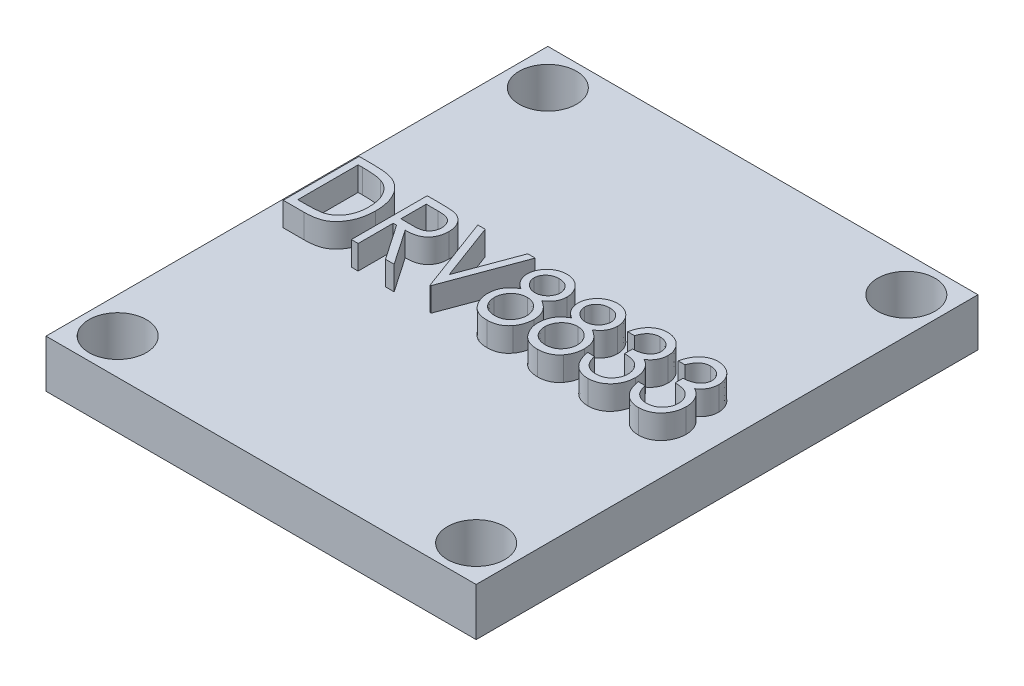
from build123d import *

# Parameters (mm, degrees)
SKETCH1_W           = 18
SKETCH1_H           = 21
SKETCH1_R           = 1.2
BOSS_EXTRUDE1_DEPTH = 2
BOSS_EXTRUDE2_DEPTH = 1


with BuildPart() as part:
    # Sketch1 → Boss-Extrude1 (new body)
    with BuildSketch(Plane(origin=(0, 0, 0), x_dir=(1, 0, 0), z_dir=(0, 1, 0))):
        Rectangle(SKETCH1_W, SKETCH1_H)
        with Locations(Location((-7.5, 9, 0), (0, 0, 270))):
            Circle(SKETCH1_R, mode=Mode.SUBTRACT)
        with Locations(Location((7.5, 9, 0), (0, 0, 270))):
            Circle(SKETCH1_R, mode=Mode.SUBTRACT)
        with Locations(Location((-7.5, -9, 0), (0, 0, 270))):
            Circle(SKETCH1_R, mode=Mode.SUBTRACT)
        with Locations(Location((7.5, -9, 0), (0, 0, 270))):
            Circle(SKETCH1_R, mode=Mode.SUBTRACT)
    extrude(amount=BOSS_EXTRUDE1_DEPTH)

    # Sketch3 → Boss-Extrude2 (add)
    # profile 1 of 7: a face of its own
    with BuildSketch(Plane(origin=(0, 2, 0), x_dir=(1, 0, 0), z_dir=(0, 1, 0))):
        with BuildLine():
            Line((-7.960071153, -1.612211939), (-7.960071153, 1.562788061))
            Line((-7.960071153, 1.562788061), (-7.388927323, 1.562788061))
            add(Edge.make_bspline(
                [(-7.388927323, 1.562788061), (-7.339101901, 1.562388392), (-7.243028105, 1.561617748), (-7.10430302, 1.556696109), (-6.976155205, 1.547981639), (-6.858841549, 1.535342458), (-6.751808562, 1.519656461), (-6.655527575, 1.50032874), (-6.569557312, 1.477153035), (-6.517035662, 1.457581178), (-6.492142467, 1.448304888)],
                knots=[0, 0, 0, 0, 1.315724667, 2.53699131, 3.664990376, 4.706723947, 5.652070057, 6.520539819, 7.298794104, 8, 8, 8, 8], degree=3))
            add(Edge.make_bspline(
                [(-6.492142467, 1.448304888), (-6.459431719, 1.434249953), (-6.394351066, 1.406286534), (-6.302016848, 1.354356083), (-6.21534767, 1.295002965), (-6.13376372, 1.228481468), (-6.058528837, 1.153911169), (-5.987737915, 1.072562875), (-5.92317458, 0.983414675), (-5.863976408, 0.887365616), (-5.811525894, 0.785186605), (-5.765474991, 0.677914724), (-5.726823565, 0.565834732), (-5.694903272, 0.448991518), (-5.670226665, 0.327230926), (-5.652366179, 0.200669554), (-5.6423445, 0.069368995), (-5.640709126, -0.019607579), (-5.639878845, -0.06478105)],
                knots=[0, 0, 0, 0, 0.924800359, 1.839964368, 2.747783831, 3.652252776, 4.571785451, 5.497553767, 6.451983905, 7.429142128, 8.427204497, 9.434321214, 10.460683131, 11.505979534, 12.580111876, 13.687410116, 14.825896436, 16, 16, 16, 16], degree=3))
            add(Edge.make_bspline(
                [(-5.639878845, -0.06478105), (-5.640237589, -0.104021454), (-5.64094442, -0.181336653), (-5.650413224, -0.295301221), (-5.664371873, -0.40565144), (-5.682919838, -0.51266773), (-5.708905095, -0.615878685), (-5.739072809, -0.715873357), (-5.775378361, -0.812147334), (-5.817468442, -0.904123068), (-5.863454223, -0.991478457), (-5.913560178, -1.073182882), (-5.965615961, -1.149813194), (-6.023072104, -1.219224485), (-6.082410945, -1.283741223), (-6.145803069, -1.341762887), (-6.212172048, -1.39430584), (-6.282643532, -1.441172301), (-6.358476595, -1.482371446), (-6.441116189, -1.517447074), (-6.53089762, -1.546223611), (-6.627548255, -1.570480293), (-6.731409141, -1.589583408), (-6.842546708, -1.602365536), (-6.960748931, -1.611072954), (-7.041856733, -1.611824688), (-7.083638861, -1.612211939)],
                knots=[0, 0, 0, 0, 1.170566915, 2.306362916, 3.409558859, 4.489123214, 5.544697587, 6.583245604, 7.604248301, 8.612055345, 9.599647246, 10.547858778, 11.470856558, 12.361035986, 13.233851144, 14.084492039, 14.922287147, 15.757427099, 16.606608392, 17.49372568, 18.431945823, 19.416941035, 20.465383131, 21.580359581, 22.753538819, 24, 24, 24, 24], degree=3))
            Line((-7.083638861, -1.612211939), (-7.960071153, -1.612211939))
        make_face()
        with BuildLine():
            Line((-7.675135256, -1.286570913), (-7.361578565, -1.286570913))
            add(Edge.make_bspline(
                [(-7.361578565, -1.286570913), (-7.316418401, -1.286350158), (-7.229896683, -1.285927216), (-7.105412118, -1.282096991), (-6.991729279, -1.275895943), (-6.888609243, -1.267245808), (-6.796356987, -1.255710995), (-6.714698538, -1.242889009), (-6.643772196, -1.226872555), (-6.601019922, -1.212475986), (-6.581184935, -1.205796675)],
                knots=[0, 0, 0, 0, 1.375935935, 2.63613619, 3.794191116, 4.844531808, 5.788349761, 6.626220458, 7.362632744, 8, 8, 8, 8], degree=3))
            add(Edge.make_bspline(
                [(-6.581184935, -1.205796675), (-6.556217292, -1.195568236), (-6.506673727, -1.175271834), (-6.435619209, -1.138432074), (-6.36956216, -1.094603549), (-6.306559555, -1.046469069), (-6.248732401, -0.991190485), (-6.194659474, -0.930839021), (-6.144615499, -0.864714079), (-6.099116836, -0.792918506), (-6.057837757, -0.716300864), (-6.02214499, -0.635261868), (-5.992310724, -0.550126488), (-5.967305702, -0.460964412), (-5.948604935, -0.367352431), (-5.934499791, -0.269929955), (-5.926072419, -0.168389877), (-5.925239526, -0.09935398), (-5.924814743, -0.064145032)],
                knots=[0, 0, 0, 0, 0.921437272, 1.828417929, 2.728287179, 3.626406277, 4.533155606, 5.456327229, 6.391997779, 7.362338549, 8.357046705, 9.362218445, 10.383770442, 11.436248382, 12.522758724, 13.64217368, 14.797486672, 16, 16, 16, 16], degree=3))
            add(Edge.make_bspline(
                [(-5.924814743, -0.064145032), (-5.925443885, -0.027024775), (-5.92667885, 0.045839864), (-5.935836191, 0.152860314), (-5.950145306, 0.255752845), (-5.971335263, 0.354484308), (-5.997893319, 0.449303225), (-6.030355974, 0.540179591), (-6.069185519, 0.626665854), (-6.113729823, 0.708661123), (-6.163043282, 0.785740764), (-6.21789642, 0.856498362), (-6.277456251, 0.92095002), (-6.340854785, 0.980062067), (-6.410268104, 1.031389182), (-6.483277517, 1.077569678), (-6.561607553, 1.116685122), (-6.61639751, 1.137540524), (-6.64415068, 1.148104567)],
                knots=[0, 0, 0, 0, 1.181456899, 2.31912264, 3.416650319, 4.486100574, 5.530800009, 6.549007929, 7.554886024, 8.545342906, 9.516858806, 10.464454463, 11.390981978, 12.307973961, 13.219011793, 14.134637004, 15.055123625, 16, 16, 16, 16], degree=3))
            add(Edge.make_bspline(
                [(-6.64415068, 1.148104567), (-6.666945911, 1.155467824), (-6.71540125, 1.171119743), (-6.794920983, 1.188157045), (-6.884479406, 1.203286127), (-6.984406527, 1.215988123), (-7.094553101, 1.225159901), (-7.214801612, 1.232027789), (-7.345429974, 1.236672411), (-7.435988325, 1.236984711), (-7.483057932, 1.237147035)],
                knots=[0, 0, 0, 0, 0.678535917, 1.442349433, 2.301734165, 3.252693306, 4.296065182, 5.433594972, 6.666057041, 8, 8, 8, 8], degree=3))
            Line((-7.483057932, 1.237147035), (-7.675135256, 1.237147035))
            Line((-7.675135256, 1.237147035), (-7.675135256, -1.286570913))
        make_face(mode=Mode.SUBTRACT)
    # profile 2 of 7: a face of its own
    with BuildSketch(Plane(origin=(0, 2, 0), x_dir=(1, 0, 0), z_dir=(0, 1, 0))):
        with BuildLine():
            Line((-5.110712179, 1.562788061), (-4.553560736, 1.562788061))
            add(Edge.make_bspline(
                [(-4.553560736, 1.562788061), (-4.51624802, 1.562648519), (-4.444797274, 1.562381309), (-4.342363299, 1.56085547), (-4.249320362, 1.556530756), (-4.165488682, 1.552812312), (-4.091118716, 1.545991611), (-4.026101066, 1.539588026), (-3.970450852, 1.530859333), (-3.936801094, 1.523099741), (-3.921359214, 1.519538862)],
                knots=[0, 0, 0, 0, 1.410548186, 2.701082353, 3.872164956, 4.931545487, 5.872643019, 6.694846481, 7.4010648, 8, 8, 8, 8], degree=3))
            add(Edge.make_bspline(
                [(-3.921359214, 1.519538862), (-3.901086918, 1.513781587), (-3.860765468, 1.502330408), (-3.802881129, 1.478299624), (-3.74746026, 1.450476672), (-3.694899137, 1.417948608), (-3.645899955, 1.380215332), (-3.59994018, 1.337883569), (-3.556366295, 1.291255915), (-3.51622011, 1.240027924), (-3.478857224, 1.185432353), (-3.447305698, 1.126862261), (-3.420566401, 1.065303461), (-3.397812132, 1.001081495), (-3.382104048, 0.933301722), (-3.368568101, 0.862997404), (-3.362068908, 0.789300944), (-3.360956306, 0.739153888), (-3.360391666, 0.713704527)],
                knots=[0, 0, 0, 0, 0.953385732, 1.896277294, 2.832058144, 3.758936013, 4.690028676, 5.627530842, 6.585110904, 7.575978385, 8.571622722, 9.576661008, 10.582432364, 11.608427265, 12.656015072, 13.729146958, 14.84755428, 16, 16, 16, 16], degree=3))
            add(Edge.make_bspline(
                [(-3.360391666, 0.713704527), (-3.361772323, 0.671440183), (-3.364459251, 0.589188625), (-3.384285686, 0.469619602), (-3.418157035, 0.358034921), (-3.465123738, 0.254856722), (-3.524248985, 0.161411029), (-3.595595097, 0.079288006), (-3.679333906, 0.010435032), (-3.757541787, -0.037525173), (-3.82671784, -0.068229811), (-3.883403846, -0.089692981), (-3.94536265, -0.106196135), (-4.011694372, -0.121143465), (-4.082881308, -0.132327822), (-4.158862723, -0.140548628), (-4.239511133, -0.145658033), (-4.294906009, -0.146430874), (-4.323322355, -0.146827324)],
                knots=[0, 0, 0, 0, 1.376286419, 2.678420862, 3.934476393, 5.16434824, 6.359712899, 7.524467423, 8.691553218, 9.878209641, 10.499433377, 11.154907673, 11.850203166, 12.585724918, 13.369062201, 14.195702105, 15.074435089, 16, 16, 16, 16], degree=3))
            Line((-4.323322355, -0.146827324), (-3.319686538, -1.612211939))
            Line((-3.319686538, -1.612211939), (-3.680944551, -1.612211939))
            Line((-3.680944551, -1.612211939), (-4.68394435, -0.146827324))
            Line((-4.68394435, -0.146827324), (-4.825776281, -0.146827324))
            Line((-4.825776281, -0.146827324), (-4.825776281, -1.612211939))
            Line((-4.825776281, -1.612211939), (-5.110712179, -1.612211939))
            Line((-5.110712179, -1.612211939), (-5.110712179, 1.562788061))
        make_face()
        with BuildLine():
            Line((-4.825776281, 1.237147035), (-4.825776281, 0.178813702))
            Line((-4.825776281, 0.178813702), (-4.344310937, 0.174361579))
            add(Edge.make_bspline(
                [(-4.344310937, 0.174361579), (-4.321832354, 0.174352278), (-4.278122016, 0.174334192), (-4.214944306, 0.177942121), (-4.156148082, 0.1820529), (-4.102031931, 0.188418843), (-4.052520393, 0.196456373), (-4.007521579, 0.206767136), (-3.967003802, 0.218469965), (-3.919469799, 0.237162314), (-3.866216613, 0.266230388), (-3.808398484, 0.308758399), (-3.759995076, 0.362191321), (-3.718470865, 0.422648556), (-3.685876277, 0.489652889), (-3.661969903, 0.56122811), (-3.647686964, 0.636599024), (-3.646120825, 0.688202828), (-3.645327563, 0.714340545)],
                knots=[0, 0, 0, 0, 1.065336973, 2.071582586, 2.998846003, 3.85897903, 4.653684173, 5.375320294, 6.046259432, 6.650926192, 7.793083249, 8.91264409, 10.036257247, 11.193087795, 12.379657337, 13.555538771, 14.761861912, 16, 16, 16, 16], degree=3))
            add(Edge.make_bspline(
                [(-3.645327563, 0.714340545), (-3.646035405, 0.739863997), (-3.647433855, 0.790289495), (-3.663004636, 0.863717943), (-3.686076288, 0.934089747), (-3.720402277, 0.998863619), (-3.760035013, 1.058758352), (-3.807872691, 1.10948582), (-3.861130533, 1.151666736), (-3.911405161, 1.178735979), (-3.956326721, 1.19542357), (-3.994981149, 1.206779091), (-4.038750338, 1.216374448), (-4.087668182, 1.223597916), (-4.14172385, 1.230128874), (-4.200936638, 1.234386238), (-4.265208857, 1.236963606), (-4.309751245, 1.237084373), (-4.332862619, 1.237147035)],
                knots=[0, 0, 0, 0, 1.234327139, 2.438602754, 3.620607776, 4.81008266, 5.97781748, 7.089343407, 8.171889953, 9.256139727, 9.837835946, 10.490922354, 11.205974105, 12.006200778, 12.885051669, 13.842733138, 14.880675122, 16, 16, 16, 16], degree=3))
            Line((-4.332862619, 1.237147035), (-4.825776281, 1.237147035))
        make_face(mode=Mode.SUBTRACT)
    # profile 3 of 7: a face of its own
    with BuildSketch(Plane(origin=(0, 2, 0), x_dir=(1, 0, 0), z_dir=(0, 1, 0))):
        Polygon((-2.994045512, 1.562788061), (-2.684940945, 1.562788061), (-1.79324423, -0.834998397), (-0.902183533, 1.562788061), (-0.592442948, 1.562788061), (-1.772891666, -1.612211939), (-1.813596794, -1.612211939), align=None)
    # profile 4 of 7: a face of its own
    with BuildSketch(Plane(origin=(0, 2, 0), x_dir=(1, 0, 0), z_dir=(0, 1, 0))):
        with BuildLine():
            add(Edge.make_bspline(
                [(1.08664359, 0.156553085), (1.109486988, 0.143027281), (1.153991087, 0.116675961), (1.216784475, 0.073657754), (1.274278017, 0.029200336), (1.327681528, -0.015659428), (1.374879048, -0.063290205), (1.417381356, -0.11177808), (1.454744846, -0.162021293), (1.497756977, -0.23040339), (1.541619597, -0.320949763), (1.578516133, -0.436816044), (1.601355396, -0.559767507), (1.604188374, -0.644304904), (1.605633975, -0.687442308)],
                knots=[0, 0, 0, 0, 0.914362454, 1.781384597, 2.619883779, 3.417600481, 4.181920405, 4.927374046, 5.637276055, 6.336350791, 7.708254165, 9.089438062, 10.514810145, 12, 12, 12, 12], degree=3))
            add(Edge.make_bspline(
                [(1.605633975, -0.687442308), (1.605102122, -0.718003663), (1.604050136, -0.778452846), (1.593276051, -0.867703624), (1.577231708, -0.954409164), (1.553121666, -1.038237451), (1.5236865, -1.119480081), (1.486759829, -1.197812986), (1.443998376, -1.273766702), (1.409779306, -1.321217905), (1.39256807, -1.345084535)],
                knots=[0, 0, 0, 0, 1.041882803, 2.060804048, 3.06202158, 4.046332822, 5.03231592, 6.006025776, 6.99708666, 8, 8, 8, 8], degree=3))
            add(Edge.make_bspline(
                [(1.39256807, -1.345084535), (1.370331814, -1.372815651), (1.326301316, -1.42772664), (1.249445207, -1.498827852), (1.16601013, -1.559375702), (1.075419063, -1.608850344), (0.977636712, -1.646809221), (0.872950012, -1.674479895), (0.76126411, -1.690148824), (0.68451622, -1.692446543), (0.645247357, -1.693622195)],
                knots=[0, 0, 0, 0, 0.994201578, 1.968640301, 2.92098468, 3.874697238, 4.850310626, 5.851048309, 6.900466311, 8, 8, 8, 8], degree=3))
            add(Edge.make_bspline(
                [(0.645247357, -1.693622195), (0.607258574, -1.692588204), (0.533557176, -1.690582173), (0.426265201, -1.676694352), (0.326387141, -1.652435376), (0.233015673, -1.619583234), (0.14720888, -1.575949392), (0.068599393, -1.522734182), (-0.003655422, -1.460633967), (-0.066944876, -1.388714068), (-0.122934507, -1.311508764), (-0.172029618, -1.231655352), (-0.2145583, -1.150358503), (-0.24798049, -1.06639865), (-0.275349437, -0.981135413), (-0.293252951, -0.893448431), (-0.305412484, -0.80417418), (-0.306805638, -0.743876938), (-0.307507051, -0.71351903)],
                knots=[0, 0, 0, 0, 1.189830096, 2.308369381, 3.38102576, 4.403937896, 5.401777142, 6.387120394, 7.37100814, 8.377427796, 9.380226239, 10.35513181, 11.31145126, 12.249850496, 13.182357426, 14.112259914, 15.049577746, 16, 16, 16, 16], degree=3))
            add(Edge.make_bspline(
                [(-0.307507051, -0.71351903), (-0.306045362, -0.669540393), (-0.303180121, -0.583332328), (-0.280507974, -0.457529805), (-0.242609352, -0.338778618), (-0.198945274, -0.245175895), (-0.156110863, -0.173755686), (-0.117441062, -0.122264934), (-0.07408693, -0.071914506), (-0.025519236, -0.022724875), (0.028499625, 0.024821106), (0.088104509, 0.070723502), (0.152756279, 0.115292716), (0.198806489, 0.142616073), (0.222295634, 0.156553085)],
                knots=[0, 0, 0, 0, 1.473281155, 2.887963909, 4.267687182, 5.640863319, 6.339108383, 7.055342466, 7.795973019, 8.564700607, 9.370150118, 10.205839621, 11.084840353, 12, 12, 12, 12], degree=3))
            add(Edge.make_bspline(
                [(0.222295634, 0.156553085), (0.189936832, 0.176754184), (0.12666348, 0.216254758), (0.043325142, 0.287371615), (-0.028049354, 0.364956376), (-0.085199119, 0.449988461), (-0.129919661, 0.539901896), (-0.161927724, 0.633546558), (-0.181818248, 0.730462598), (-0.184194479, 0.796293153), (-0.185391666, 0.829459736)],
                knots=[0, 0, 0, 0, 1.108078529, 2.1667008, 3.174911676, 4.165013377, 5.13557244, 6.087046531, 7.036220656, 8, 8, 8, 8], degree=3))
            add(Edge.make_bspline(
                [(-0.185391666, 0.829459736), (-0.184050773, 0.863279915), (-0.181360147, 0.931143213), (-0.159112862, 1.032067816), (-0.124145821, 1.13175196), (-0.074829903, 1.228390957), (-0.015027771, 1.320541824), (0.058538513, 1.402044014), (0.141339053, 1.474578742), (0.234761161, 1.534948547), (0.335023391, 1.583970037), (0.440821571, 1.618356686), (0.550208037, 1.640317726), (0.624790533, 1.642896993), (0.662419832, 1.644198317)],
                knots=[0, 0, 0, 0, 0.933393775, 1.872940412, 2.841657425, 3.844761966, 4.863186887, 5.867009188, 6.867494675, 7.895706246, 8.930319001, 9.941494413, 10.961416858, 12, 12, 12, 12], degree=3))
            add(Edge.make_bspline(
                [(0.662419832, 1.644198317), (0.69919649, 1.642883291), (0.77187976, 1.64028435), (0.878781343, 1.618585271), (0.981056641, 1.582598791), (1.078237862, 1.533540188), (1.168591509, 1.473061804), (1.248474328, 1.400302119), (1.318634679, 1.318194011), (1.377163181, 1.227026584), (1.424127242, 1.129770545), (1.459056017, 1.029199), (1.47917026, 0.925447463), (1.482065019, 0.855619063), (1.48351859, 0.820555489)],
                knots=[0, 0, 0, 0, 1.025177658, 2.026102131, 3.028615222, 4.041574873, 5.055259337, 6.051788893, 7.046052148, 8.059822865, 9.064931678, 10.052400243, 11.022033903, 12, 12, 12, 12], degree=3))
            add(Edge.make_bspline(
                [(1.48351859, 0.820555489), (1.482293547, 0.786128479), (1.479893157, 0.718671033), (1.461105241, 0.620347249), (1.429671618, 0.527960916), (1.386053733, 0.441097251), (1.329574849, 0.360451481), (1.260078043, 0.286152768), (1.179508715, 0.216257144), (1.1181365, 0.17680024), (1.08664359, 0.156553085)],
                knots=[0, 0, 0, 0, 1.017158402, 1.993054549, 2.946292347, 3.893578809, 4.856714948, 5.845702908, 6.894530941, 8, 8, 8, 8], degree=3))
        make_face()
        with BuildLine():
            add(Edge.make_bspline(
                [(0.647791427, 1.318557292), (0.628486741, 1.317965487), (0.590622329, 1.316804716), (0.534965338, 1.310729306), (0.482039746, 1.299011429), (0.431325702, 1.283417001), (0.38364014, 1.261765366), (0.337438069, 1.237536775), (0.294780802, 1.207052108), (0.254895456, 1.173061216), (0.219142127, 1.135629139), (0.186812656, 1.096938114), (0.160083261, 1.055785032), (0.137512831, 1.013146236), (0.120397694, 0.96848125), (0.108136004, 0.922229648), (0.101126322, 0.874195836), (0.100076823, 0.841566238), (0.099544232, 0.825007612)],
                knots=[0, 0, 0, 0, 1.128425343, 2.213305224, 3.265437279, 4.291949646, 5.307035918, 6.32144161, 7.335317645, 8.363249344, 9.379544413, 10.356652003, 11.304985507, 12.241430786, 13.170884807, 14.093377769, 15.032441564, 16, 16, 16, 16], degree=3))
            add(Edge.make_bspline(
                [(0.099544232, 0.825007612), (0.100024647, 0.808442982), (0.100972261, 0.775769407), (0.108826244, 0.727274574), (0.122327177, 0.680219036), (0.140843281, 0.634153142), (0.164779794, 0.589367899), (0.193191467, 0.545487665), (0.227543489, 0.503121705), (0.266340237, 0.462588767), (0.308443751, 0.424684215), (0.352921975, 0.391272255), (0.399929586, 0.363951646), (0.448129774, 0.340918067), (0.498176583, 0.32289742), (0.549971077, 0.310223155), (0.603453526, 0.302371047), (0.639708641, 0.301412059), (0.657967709, 0.300929087)],
                knots=[0, 0, 0, 0, 0.941109226, 1.856328975, 2.783214069, 3.718519893, 4.672576731, 5.66519449, 6.685154655, 7.767547646, 8.851281227, 9.90202341, 10.922908451, 11.936227576, 12.934824575, 13.940159871, 14.962608181, 16, 16, 16, 16], degree=3))
            add(Edge.make_bspline(
                [(0.657967709, 0.300929087), (0.681571787, 0.301722469), (0.728567176, 0.303302081), (0.797647646, 0.31796216), (0.864643354, 0.341228139), (0.929083481, 0.372792659), (0.989363237, 0.412323908), (1.042448569, 0.460276677), (1.089640332, 0.513756262), (1.127857556, 0.574296056), (1.158377935, 0.637691361), (1.182140056, 0.701768338), (1.195891804, 0.766542439), (1.197691358, 0.809894922), (1.198582693, 0.831367788)],
                knots=[0, 0, 0, 0, 1.013084994, 2.017038092, 3.019502504, 4.054223377, 5.092546353, 6.10542658, 7.119125627, 8.147492291, 9.170033384, 10.138140416, 11.077804571, 12, 12, 12, 12], degree=3))
            add(Edge.make_bspline(
                [(1.198582693, 0.831367788), (1.196825148, 0.861228864), (1.193317129, 0.920830854), (1.166002563, 1.008122347), (1.119810763, 1.090243957), (1.069644333, 1.154902302), (1.020540979, 1.201431059), (0.979341316, 1.233382212), (0.933617262, 1.259658743), (0.884050651, 1.28178054), (0.830506361, 1.297798028), (0.773153843, 1.310293527), (0.711762087, 1.316955754), (0.669429888, 1.318015562), (0.647791427, 1.318557292)],
                knots=[0, 0, 0, 0, 1.307320902, 2.609381067, 3.96494532, 5.420448181, 6.176278048, 6.925223031, 7.699726536, 8.48182856, 9.298861196, 10.144453644, 11.051521825, 12, 12, 12, 12], degree=3))
        make_face(mode=Mode.SUBTRACT)
        with BuildLine():
            add(Edge.make_bspline(
                [(0.663691868, -0.024711939), (0.639903048, -0.025229541), (0.592947716, -0.026251206), (0.524265762, -0.037138801), (0.458189583, -0.05252013), (0.39530243, -0.075812719), (0.335432114, -0.105769477), (0.278475486, -0.142452746), (0.22424013, -0.1851145), (0.173818863, -0.233944783), (0.127904489, -0.286758362), (0.087363763, -0.342342672), (0.053616389, -0.400372787), (0.026010382, -0.460696762), (0.004521416, -0.523148506), (-0.011872521, -0.587719643), (-0.020552882, -0.654767275), (-0.02189383, -0.700140792), (-0.022571153, -0.723059295)],
                knots=[0, 0, 0, 0, 1.048421666, 2.069416987, 3.060597679, 4.036932712, 5.019740262, 6.008093548, 7.02022806, 8.058591887, 9.099311237, 10.103813435, 11.088621048, 12.055279132, 13.02532386, 13.998339084, 14.988946113, 16, 16, 16, 16], degree=3))
            add(Edge.make_bspline(
                [(-0.022571153, -0.723059295), (-0.021695771, -0.751553611), (-0.019963516, -0.807939738), (-0.002876691, -0.891144125), (0.022725207, -0.972169339), (0.059990226, -1.049536366), (0.105488707, -1.121808043), (0.161402927, -1.185710441), (0.224944481, -1.241270907), (0.297022465, -1.287351601), (0.375948894, -1.323773471), (0.461529001, -1.348733241), (0.552581566, -1.365524126), (0.615486973, -1.367147501), (0.647791427, -1.36798117)],
                knots=[0, 0, 0, 0, 0.983353418, 1.945914075, 2.923520839, 3.913075695, 4.904716137, 5.865351531, 6.836321414, 7.811675056, 8.811399656, 9.82878879, 10.884995781, 12, 12, 12, 12], degree=3))
            add(Edge.make_bspline(
                [(0.647791427, -1.36798117), (0.672837411, -1.367382794), (0.722056808, -1.366206888), (0.793668194, -1.356648325), (0.861419346, -1.340615053), (0.924917709, -1.318393423), (0.985040793, -1.290190426), (1.040720504, -1.25532809), (1.092520235, -1.213858787), (1.139404426, -1.166540395), (1.181940412, -1.11520361), (1.218926707, -1.061071197), (1.250091523, -1.004717248), (1.276583982, -0.946909191), (1.296384268, -0.886483735), (1.310006397, -0.824012048), (1.31966187, -0.75939821), (1.320349233, -0.71546373), (1.320698078, -0.693166466)],
                knots=[0, 0, 0, 0, 1.127389244, 2.215501698, 3.245805524, 4.257141659, 5.239223727, 6.229804829, 7.207749447, 8.220211165, 9.223632865, 10.205900477, 11.167354178, 12.120096853, 13.064916475, 14.023665393, 14.996987016, 16, 16, 16, 16], degree=3))
            add(Edge.make_bspline(
                [(1.320698078, -0.693166466), (1.320053738, -0.671512296), (1.318784792, -0.628867121), (1.309675054, -0.56575286), (1.294318159, -0.504672037), (1.273222568, -0.445259731), (1.246435557, -0.387610287), (1.21311665, -0.332031915), (1.173391087, -0.278650048), (1.128629971, -0.227475961), (1.079693289, -0.180450757), (1.027909317, -0.138381499), (0.973091956, -0.103581251), (0.91610799, -0.074546309), (0.856582239, -0.052177179), (0.794532097, -0.036308935), (0.729940341, -0.026467716), (0.685987583, -0.02530284), (0.663691868, -0.024711939)],
                knots=[0, 0, 0, 0, 1.001088024, 1.971517479, 2.94155076, 3.908905619, 4.882498667, 5.876071198, 6.899515427, 7.955402232, 9.016146846, 10.034225051, 11.034929039, 12.012560479, 12.98664691, 13.968593758, 14.969537786, 16, 16, 16, 16], degree=3))
        make_face(mode=Mode.SUBTRACT)
    # profile 5 of 7: a face of its own
    with BuildSketch(Plane(origin=(0, 2, 0), x_dir=(1, 0, 0), z_dir=(0, 1, 0))):
        with BuildLine():
            add(Edge.make_bspline(
                [(3.203310257, 0.156553085), (3.226153655, 0.143027281), (3.270657754, 0.116675961), (3.333451142, 0.073657754), (3.390944684, 0.029200336), (3.444348195, -0.015659428), (3.491545715, -0.063290205), (3.534048023, -0.11177808), (3.571411513, -0.162021293), (3.614423643, -0.23040339), (3.658286264, -0.320949763), (3.6951828, -0.436816044), (3.718022063, -0.559767507), (3.720855041, -0.644304904), (3.722300642, -0.687442308)],
                knots=[0, 0, 0, 0, 0.914362454, 1.781384597, 2.619883779, 3.417600481, 4.181920405, 4.927374046, 5.637276055, 6.336350791, 7.708254165, 9.089438062, 10.514810145, 12, 12, 12, 12], degree=3))
            add(Edge.make_bspline(
                [(3.722300642, -0.687442308), (3.721768788, -0.718003663), (3.720716802, -0.778452846), (3.709942718, -0.867703624), (3.693898375, -0.954409164), (3.669788333, -1.038237451), (3.640353166, -1.119480081), (3.603426496, -1.197812986), (3.560665043, -1.273766702), (3.526445973, -1.321217905), (3.509234736, -1.345084535)],
                knots=[0, 0, 0, 0, 1.041882803, 2.060804048, 3.06202158, 4.046332822, 5.03231592, 6.006025776, 6.99708666, 8, 8, 8, 8], degree=3))
            add(Edge.make_bspline(
                [(3.509234736, -1.345084535), (3.48699848, -1.372815651), (3.442967983, -1.42772664), (3.366111874, -1.498827852), (3.282676796, -1.559375702), (3.19208573, -1.608850344), (3.094303378, -1.646809221), (2.989616678, -1.674479895), (2.877930777, -1.690148824), (2.801182887, -1.692446543), (2.761914023, -1.693622195)],
                knots=[0, 0, 0, 0, 0.994201578, 1.968640301, 2.92098468, 3.874697238, 4.850310626, 5.851048309, 6.900466311, 8, 8, 8, 8], degree=3))
            add(Edge.make_bspline(
                [(2.761914023, -1.693622195), (2.723925241, -1.692588204), (2.650223843, -1.690582173), (2.542931868, -1.676694352), (2.443053808, -1.652435376), (2.34968234, -1.619583234), (2.263875547, -1.575949392), (2.185266059, -1.522734182), (2.113011244, -1.460633967), (2.04972179, -1.388714068), (1.993732159, -1.311508764), (1.944637049, -1.231655352), (1.902108367, -1.150358503), (1.868686177, -1.06639865), (1.841317229, -0.981135413), (1.823413716, -0.893448431), (1.811254182, -0.80417418), (1.809861029, -0.743876938), (1.809159616, -0.71351903)],
                knots=[0, 0, 0, 0, 1.189830096, 2.308369381, 3.38102576, 4.403937896, 5.401777142, 6.387120394, 7.37100814, 8.377427796, 9.380226239, 10.35513181, 11.31145126, 12.249850496, 13.182357426, 14.112259914, 15.049577746, 16, 16, 16, 16], degree=3))
            add(Edge.make_bspline(
                [(1.809159616, -0.71351903), (1.810621305, -0.669540393), (1.813486545, -0.583332328), (1.836158692, -0.457529805), (1.874057315, -0.338778618), (1.917721393, -0.245175895), (1.960555804, -0.173755686), (1.999225605, -0.122264934), (2.042579736, -0.071914506), (2.09114743, -0.022724875), (2.145166292, 0.024821106), (2.204771176, 0.070723502), (2.269422945, 0.115292716), (2.315473155, 0.142616073), (2.3389623, 0.156553085)],
                knots=[0, 0, 0, 0, 1.473281155, 2.887963909, 4.267687182, 5.640863319, 6.339108383, 7.055342466, 7.795973019, 8.564700607, 9.370150118, 10.205839621, 11.084840353, 12, 12, 12, 12], degree=3))
            add(Edge.make_bspline(
                [(2.3389623, 0.156553085), (2.306603498, 0.176754184), (2.243330146, 0.216254758), (2.159991808, 0.287371615), (2.088617312, 0.364956376), (2.031467548, 0.449988461), (1.986747005, 0.539901896), (1.954738943, 0.633546558), (1.934848418, 0.730462598), (1.932472187, 0.796293153), (1.931275001, 0.829459736)],
                knots=[0, 0, 0, 0, 1.108078529, 2.1667008, 3.174911676, 4.165013377, 5.13557244, 6.087046531, 7.036220656, 8, 8, 8, 8], degree=3))
            add(Edge.make_bspline(
                [(1.931275001, 0.829459736), (1.932615894, 0.863279915), (1.935306519, 0.931143213), (1.957553805, 1.032067816), (1.992520846, 1.13175196), (2.041836764, 1.228390957), (2.101638895, 1.320541824), (2.17520518, 1.402044014), (2.258005719, 1.474578742), (2.351427828, 1.534948547), (2.451690058, 1.583970037), (2.557488238, 1.618356686), (2.666874704, 1.640317726), (2.7414572, 1.642896993), (2.779086499, 1.644198317)],
                knots=[0, 0, 0, 0, 0.933393775, 1.872940412, 2.841657425, 3.844761966, 4.863186887, 5.867009188, 6.867494675, 7.895706246, 8.930319001, 9.941494413, 10.961416858, 12, 12, 12, 12], degree=3))
            add(Edge.make_bspline(
                [(2.779086499, 1.644198317), (2.815863157, 1.642883291), (2.888546427, 1.64028435), (2.99544801, 1.618585271), (3.097723308, 1.582598791), (3.194904529, 1.533540188), (3.285258176, 1.473061804), (3.365140994, 1.400302119), (3.435301346, 1.318194011), (3.493829848, 1.227026584), (3.540793909, 1.129770545), (3.575722684, 1.029199), (3.595836927, 0.925447463), (3.598731686, 0.855619063), (3.600185257, 0.820555489)],
                knots=[0, 0, 0, 0, 1.025177658, 2.026102131, 3.028615222, 4.041574873, 5.055259337, 6.051788893, 7.046052148, 8.059822865, 9.064931678, 10.052400243, 11.022033903, 12, 12, 12, 12], degree=3))
            add(Edge.make_bspline(
                [(3.600185257, 0.820555489), (3.598960214, 0.786128479), (3.596559823, 0.718671033), (3.577771908, 0.620347249), (3.546338285, 0.527960916), (3.502720399, 0.441097251), (3.446241516, 0.360451481), (3.376744709, 0.286152768), (3.296175382, 0.216257144), (3.234803167, 0.17680024), (3.203310257, 0.156553085)],
                knots=[0, 0, 0, 0, 1.017158402, 1.993054549, 2.946292347, 3.893578809, 4.856714948, 5.845702908, 6.894530941, 8, 8, 8, 8], degree=3))
        make_face()
        with BuildLine():
            add(Edge.make_bspline(
                [(2.764458094, 1.318557292), (2.745153408, 1.317965487), (2.707288995, 1.316804716), (2.651632005, 1.310729306), (2.598706412, 1.299011429), (2.547992369, 1.283417001), (2.500306807, 1.261765366), (2.454104736, 1.237536775), (2.411447469, 1.207052108), (2.371562122, 1.173061216), (2.335808793, 1.135629139), (2.303479323, 1.096938114), (2.276749928, 1.055785032), (2.254179498, 1.013146236), (2.23706436, 0.96848125), (2.22480267, 0.922229648), (2.217792989, 0.874195836), (2.21674349, 0.841566238), (2.216210898, 0.825007612)],
                knots=[0, 0, 0, 0, 1.128425343, 2.213305224, 3.265437279, 4.291949646, 5.307035918, 6.32144161, 7.335317645, 8.363249344, 9.379544413, 10.356652003, 11.304985507, 12.241430786, 13.170884807, 14.093377769, 15.032441564, 16, 16, 16, 16], degree=3))
            add(Edge.make_bspline(
                [(2.216210898, 0.825007612), (2.216691313, 0.808442982), (2.217638928, 0.775769407), (2.22549291, 0.727274574), (2.238993844, 0.680219036), (2.257509948, 0.634153142), (2.281446461, 0.589367899), (2.309858134, 0.545487665), (2.344210156, 0.503121705), (2.383006904, 0.462588767), (2.425110417, 0.424684215), (2.469588642, 0.391272255), (2.516596253, 0.363951646), (2.56479644, 0.340918067), (2.61484325, 0.32289742), (2.666637744, 0.310223155), (2.720120192, 0.302371047), (2.756375308, 0.301412059), (2.774634376, 0.300929087)],
                knots=[0, 0, 0, 0, 0.941109226, 1.856328975, 2.783214069, 3.718519893, 4.672576731, 5.66519449, 6.685154655, 7.767547646, 8.851281227, 9.90202341, 10.922908451, 11.936227576, 12.934824575, 13.940159871, 14.962608181, 16, 16, 16, 16], degree=3))
            add(Edge.make_bspline(
                [(2.774634376, 0.300929087), (2.798238453, 0.301722469), (2.845233843, 0.303302081), (2.914314313, 0.31796216), (2.98131002, 0.341228139), (3.045750147, 0.372792659), (3.106029903, 0.412323908), (3.159115236, 0.460276677), (3.206306998, 0.513756262), (3.244524223, 0.574296056), (3.275044601, 0.637691361), (3.298806722, 0.701768338), (3.312558471, 0.766542439), (3.314358025, 0.809894922), (3.31524936, 0.831367788)],
                knots=[0, 0, 0, 0, 1.013084994, 2.017038092, 3.019502504, 4.054223377, 5.092546353, 6.10542658, 7.119125627, 8.147492291, 9.170033384, 10.138140416, 11.077804571, 12, 12, 12, 12], degree=3))
            add(Edge.make_bspline(
                [(3.31524936, 0.831367788), (3.313491814, 0.861228864), (3.309983796, 0.920830854), (3.28266923, 1.008122347), (3.236477429, 1.090243957), (3.186310999, 1.154902302), (3.137207646, 1.201431059), (3.096007983, 1.233382212), (3.050283929, 1.259658743), (3.000717318, 1.28178054), (2.947173028, 1.297798028), (2.889820509, 1.310293527), (2.828428754, 1.316955754), (2.786096554, 1.318015562), (2.764458094, 1.318557292)],
                knots=[0, 0, 0, 0, 1.307320902, 2.609381067, 3.96494532, 5.420448181, 6.176278048, 6.925223031, 7.699726536, 8.48182856, 9.298861196, 10.144453644, 11.051521825, 12, 12, 12, 12], degree=3))
        make_face(mode=Mode.SUBTRACT)
        with BuildLine():
            add(Edge.make_bspline(
                [(2.780358534, -0.024711939), (2.756569715, -0.025229541), (2.709614382, -0.026251206), (2.640932429, -0.037138801), (2.57485625, -0.05252013), (2.511969096, -0.075812719), (2.452098781, -0.105769477), (2.395142152, -0.142452746), (2.340906797, -0.1851145), (2.29048553, -0.233944783), (2.244571156, -0.286758362), (2.20403043, -0.342342672), (2.170283056, -0.400372787), (2.142677048, -0.460696762), (2.121188082, -0.523148506), (2.104794146, -0.587719643), (2.096113785, -0.654767275), (2.094772837, -0.700140792), (2.094095514, -0.723059295)],
                knots=[0, 0, 0, 0, 1.048421666, 2.069416987, 3.060597679, 4.036932712, 5.019740262, 6.008093548, 7.02022806, 8.058591887, 9.099311237, 10.103813435, 11.088621048, 12.055279132, 13.02532386, 13.998339084, 14.988946113, 16, 16, 16, 16], degree=3))
            add(Edge.make_bspline(
                [(2.094095514, -0.723059295), (2.094970896, -0.751553611), (2.096703151, -0.807939738), (2.113789975, -0.891144125), (2.139391873, -0.972169339), (2.176656893, -1.049536366), (2.222155374, -1.121808043), (2.278069594, -1.185710441), (2.341611148, -1.241270907), (2.413689131, -1.287351601), (2.49261556, -1.323773471), (2.578195667, -1.348733241), (2.669248233, -1.365524126), (2.732153639, -1.367147501), (2.764458094, -1.36798117)],
                knots=[0, 0, 0, 0, 0.983353418, 1.945914075, 2.923520839, 3.913075695, 4.904716137, 5.865351531, 6.836321414, 7.811675056, 8.811399656, 9.82878879, 10.884995781, 12, 12, 12, 12], degree=3))
            add(Edge.make_bspline(
                [(2.764458094, -1.36798117), (2.789504077, -1.367382794), (2.838723475, -1.366206888), (2.91033486, -1.356648325), (2.978086013, -1.340615053), (3.041584376, -1.318393423), (3.10170746, -1.290190426), (3.157387171, -1.25532809), (3.209186901, -1.213858787), (3.256071092, -1.166540395), (3.298607078, -1.11520361), (3.335593373, -1.061071197), (3.36675819, -1.004717248), (3.393250649, -0.946909191), (3.413050935, -0.886483735), (3.426673064, -0.824012048), (3.436328537, -0.75939821), (3.4370159, -0.71546373), (3.437364744, -0.693166466)],
                knots=[0, 0, 0, 0, 1.127389244, 2.215501698, 3.245805524, 4.257141659, 5.239223727, 6.229804829, 7.207749447, 8.220211165, 9.223632865, 10.205900477, 11.167354178, 12.120096853, 13.064916475, 14.023665393, 14.996987016, 16, 16, 16, 16], degree=3))
            add(Edge.make_bspline(
                [(3.437364744, -0.693166466), (3.436720405, -0.671512296), (3.435451458, -0.628867121), (3.42634172, -0.56575286), (3.410984826, -0.504672037), (3.389889235, -0.445259731), (3.363102223, -0.387610287), (3.329783317, -0.332031915), (3.290057754, -0.278650048), (3.245296638, -0.227475961), (3.196359955, -0.180450757), (3.144575984, -0.138381499), (3.089758623, -0.103581251), (3.032774657, -0.074546309), (2.973248905, -0.052177179), (2.911198764, -0.036308935), (2.846607008, -0.026467716), (2.80265425, -0.02530284), (2.780358534, -0.024711939)],
                knots=[0, 0, 0, 0, 1.001088024, 1.971517479, 2.94155076, 3.908905619, 4.882498667, 5.876071198, 6.899515427, 7.955402232, 9.016146846, 10.034225051, 11.034929039, 12.012560479, 12.98664691, 13.968593758, 14.969537786, 16, 16, 16, 16], degree=3))
        make_face(mode=Mode.SUBTRACT)
    # profile 6 of 7: a face of its own
    with BuildSketch(Plane(origin=(0, 2, 0), x_dir=(1, 0, 0), z_dir=(0, 1, 0))):
        with BuildLine():
            Line((4.292172437, 0.830095753), (4.007236539, 0.830095753))
            add(Edge.make_bspline(
                [(4.007236539, 0.830095753), (4.014456393, 0.862002203), (4.028530813, 0.924200798), (4.05614169, 1.013898825), (4.088482862, 1.097836313), (4.125410455, 1.176300177), (4.166629431, 1.249358437), (4.213556241, 1.316201954), (4.264018263, 1.378456994), (4.320490671, 1.433329891), (4.379262119, 1.483439389), (4.441920382, 1.525766866), (4.506578841, 1.562605406), (4.574067787, 1.592587148), (4.644477803, 1.615462708), (4.717483895, 1.631995607), (4.793044838, 1.642562439), (4.844412943, 1.643649983), (4.870312461, 1.644198317)],
                knots=[0, 0, 0, 0, 1.213646873, 2.365889363, 3.479226314, 4.54912843, 5.581579656, 6.587705624, 7.576924878, 8.55050232, 9.505464024, 10.439453725, 11.351887816, 12.264152294, 13.174752891, 14.094686289, 15.039351257, 16, 16, 16, 16], degree=3))
            add(Edge.make_bspline(
                [(4.870312461, 1.644198317), (4.908156493, 1.642935274), (4.983205553, 1.640430513), (5.093345447, 1.617865235), (5.199496746, 1.581867376), (5.300575522, 1.532477664), (5.394475951, 1.471290891), (5.478056139, 1.398831839), (5.549842189, 1.316062696), (5.609336122, 1.224371622), (5.656704023, 1.127053637), (5.691541757, 1.026585494), (5.712708453, 0.92362565), (5.715467398, 0.854149023), (5.716851924, 0.819283454)],
                knots=[0, 0, 0, 0, 1.037475548, 2.057433109, 3.071083532, 4.106583696, 5.136003477, 6.138035553, 7.131860785, 8.132253496, 9.128731291, 10.094580144, 11.043800018, 12, 12, 12, 12], degree=3))
            add(Edge.make_bspline(
                [(5.716851924, 0.819283454), (5.715753793, 0.785716771), (5.713606137, 0.720069121), (5.69670472, 0.624274946), (5.668682998, 0.533770429), (5.628916097, 0.448729318), (5.578097803, 0.368918543), (5.515848678, 0.295048269), (5.442761824, 0.226075403), (5.387267924, 0.186443015), (5.358773999, 0.166093349)],
                knots=[0, 0, 0, 0, 1.034740432, 2.023681557, 2.989439786, 3.948891607, 4.910213012, 5.898894732, 6.921165452, 8, 8, 8, 8], degree=3))
            add(Edge.make_bspline(
                [(5.358773999, 0.166093349), (5.389160579, 0.149708404), (5.449820333, 0.116999663), (5.532010913, 0.05377129), (5.606366263, -0.019772331), (5.647623875, -0.076251863), (5.668514584, -0.10485016)],
                knots=[0, 0, 0, 0, 0.994457701, 1.985203988, 2.979812114, 4, 4, 4, 4], degree=3))
            add(Edge.make_bspline(
                [(5.668514584, -0.10485016), (5.682270807, -0.125814802), (5.70966606, -0.167565481), (5.743417311, -0.233998013), (5.773173772, -0.301807296), (5.797261508, -0.371556052), (5.815733233, -0.443274301), (5.829051009, -0.516812511), (5.83768016, -0.592257591), (5.838536648, -0.643321717), (5.838967308, -0.668997796)],
                knots=[0, 0, 0, 0, 1.00515716, 2.001751025, 2.984458985, 3.97420733, 4.958128942, 5.952324961, 6.970387383, 8, 8, 8, 8], degree=3))
            add(Edge.make_bspline(
                [(5.838967308, -0.668997796), (5.837272517, -0.71340154), (5.833899733, -0.801768884), (5.809864019, -0.932975516), (5.76855617, -1.060380687), (5.712986132, -1.183266996), (5.643872731, -1.297719011), (5.561706502, -1.400167884), (5.46754539, -1.488685081), (5.362244417, -1.562422801), (5.248196759, -1.621602986), (5.126037318, -1.662508424), (4.997623433, -1.689362386), (4.909459697, -1.692185405), (4.864588302, -1.693622195)],
                knots=[0, 0, 0, 0, 1.014707837, 2.019357588, 3.036907717, 4.069166202, 5.095504868, 6.084608755, 7.061626644, 8.038980938, 9.014218756, 9.987287233, 10.975619287, 12, 12, 12, 12], degree=3))
            add(Edge.make_bspline(
                [(4.864588302, -1.693622195), (4.834456332, -1.692839855), (4.775266916, -1.691303074), (4.688256359, -1.68065431), (4.605333592, -1.66125642), (4.526076959, -1.635215138), (4.450400591, -1.60188912), (4.378382588, -1.561284124), (4.310555721, -1.512433595), (4.246991548, -1.456298238), (4.187583049, -1.393387103), (4.134073728, -1.322788833), (4.085651542, -1.245481809), (4.04243894, -1.161454034), (4.004822819, -1.070337978), (3.972609582, -0.972547474), (3.945685197, -0.867553511), (3.932570856, -0.79481363), (3.925826283, -0.757404247)],
                knots=[0, 0, 0, 0, 0.990513423, 1.945704551, 2.875515556, 3.785713825, 4.684393021, 5.589454026, 6.498450854, 7.426798081, 8.373433753, 9.338011181, 10.333830724, 11.368661367, 12.440314751, 13.570898844, 14.750737914, 16, 16, 16, 16], degree=3))
            Line((3.925826283, -0.757404247), (4.21076218, -0.757404247))
            add(Edge.make_bspline(
                [(4.21076218, -0.757404247), (4.216819337, -0.781871434), (4.228598469, -0.829451883), (4.250751121, -0.897290155), (4.272981814, -0.960547674), (4.298729267, -1.017942906), (4.325980827, -1.070291635), (4.355206487, -1.11771961), (4.386704562, -1.159727434), (4.410031958, -1.184369984), (4.421284015, -1.19625641)],
                knots=[0, 0, 0, 0, 1.227409514, 2.386898646, 3.474821375, 4.49196229, 5.448190758, 6.348047463, 7.203174547, 8, 8, 8, 8], degree=3))
            add(Edge.make_bspline(
                [(4.421284015, -1.19625641), (4.436294834, -1.209920898), (4.466025004, -1.236984549), (4.514908015, -1.272005725), (4.566299322, -1.302464515), (4.621666013, -1.325397826), (4.679027658, -1.345158079), (4.739904465, -1.358048597), (4.803698921, -1.366795631), (4.847384471, -1.367580609), (4.869676443, -1.36798117)],
                knots=[0, 0, 0, 0, 0.987786239, 1.956392453, 2.923291289, 3.889914458, 4.869410071, 5.873943724, 6.915110651, 8, 8, 8, 8], degree=3))
            add(Edge.make_bspline(
                [(4.869676443, -1.36798117), (4.894944339, -1.367436389), (4.944184969, -1.36637475), (5.016031906, -1.356168071), (5.084323105, -1.341727512), (5.148339507, -1.3186466), (5.209350853, -1.291074301), (5.265854902, -1.255790001), (5.318622566, -1.214545551), (5.367204255, -1.16785491), (5.410591553, -1.116560423), (5.448933762, -1.062992182), (5.481949052, -1.007508767), (5.50762749, -0.949150186), (5.529221462, -0.889213736), (5.543693355, -0.826670667), (5.551921151, -0.762076901), (5.553322803, -0.718418266), (5.554031411, -0.696346554)],
                knots=[0, 0, 0, 0, 1.131388683, 2.204785482, 3.246441662, 4.252851856, 5.247356788, 6.241181003, 7.22926868, 8.243715995, 9.254465245, 10.235036049, 11.192984918, 12.141087045, 13.087426855, 14.043631555, 15.010953923, 16, 16, 16, 16], degree=3))
            add(Edge.make_bspline(
                [(5.554031411, -0.696346554), (5.552947053, -0.6667934), (5.550790931, -0.60803028), (5.532941267, -0.521576753), (5.504196854, -0.438133015), (5.463985047, -0.359026637), (5.414976684, -0.285706039), (5.357471249, -0.220452645), (5.291014573, -0.166110479), (5.229382139, -0.128313552), (5.174608605, -0.103158487), (5.128116765, -0.085893218), (5.076232533, -0.071755839), (5.019471243, -0.058131235), (4.957025096, -0.046881302), (4.889325948, -0.037531221), (4.816362432, -0.029778185), (4.766020158, -0.026441349), (4.739928847, -0.024711939)],
                knots=[0, 0, 0, 0, 1.19277501, 2.371698767, 3.54972029, 4.748382554, 5.945391955, 7.103829679, 8.24739154, 9.400245482, 10.013276171, 10.679775806, 11.400814213, 12.18386578, 13.037095876, 13.962316118, 14.943912534, 16, 16, 16, 16], degree=3))
            Line((4.739928847, -0.024711939), (4.739928847, 0.300929087))
            add(Edge.make_bspline(
                [(4.739928847, 0.300929087), (4.773280013, 0.301613992), (4.838835762, 0.302960257), (4.934347711, 0.318600367), (5.025914343, 0.340905785), (5.111186296, 0.373984062), (5.188946695, 0.413380404), (5.25656147, 0.458323506), (5.312287902, 0.509247628), (5.356747624, 0.565202138), (5.390503725, 0.625077305), (5.414213408, 0.687966925), (5.429755034, 0.753227785), (5.431191901, 0.797994706), (5.431916026, 0.820555489)],
                knots=[0, 0, 0, 0, 1.243740816, 2.444722913, 3.604071008, 4.756374622, 5.850061341, 6.853181308, 7.777365241, 8.656145985, 9.510167359, 10.331781837, 11.159283104, 12, 12, 12, 12], degree=3))
            add(Edge.make_bspline(
                [(5.431916026, 0.820555489), (5.431440535, 0.83712255), (5.43049662, 0.870010409), (5.422579935, 0.918158139), (5.410348232, 0.964835811), (5.393447839, 1.009805993), (5.370638386, 1.052894306), (5.343321631, 1.094355516), (5.310638529, 1.133740426), (5.273734566, 1.171055857), (5.233701372, 1.206152992), (5.189508265, 1.235695571), (5.143327082, 1.261667336), (5.094491925, 1.282524626), (5.042893398, 1.298576358), (4.988790834, 1.30985028), (4.931984596, 1.317032969), (4.893230835, 1.318042905), (4.873492549, 1.318557292)],
                knots=[0, 0, 0, 0, 0.954298075, 1.894410913, 2.804261135, 3.732387345, 4.655998667, 5.60826082, 6.589174048, 7.600068601, 8.631142096, 9.651225118, 10.65760524, 11.681194716, 12.705294547, 13.766901717, 14.862625692, 16, 16, 16, 16], degree=3))
            add(Edge.make_bspline(
                [(4.873492549, 1.318557292), (4.841776454, 1.317297679), (4.779732997, 1.314833608), (4.690353121, 1.293033885), (4.607304852, 1.258462284), (4.544203984, 1.217346227), (4.497914651, 1.176702771), (4.464117559, 1.141741555), (4.43205212, 1.101540216), (4.40106523, 1.056794411), (4.372105085, 1.006646532), (4.343082949, 0.952714191), (4.316539615, 0.893256603), (4.300462419, 0.851583769), (4.292172437, 0.830095753)],
                knots=[0, 0, 0, 0, 1.395445339, 2.729789254, 4.027341734, 5.343352216, 6.025171276, 6.738565338, 7.482488129, 8.288221053, 9.133992859, 10.032284056, 10.985374711, 12, 12, 12, 12], degree=3))
        make_face()
    # profile 7 of 7: a face of its own
    with BuildSketch(Plane(origin=(0, 2, 0), x_dir=(1, 0, 0), z_dir=(0, 1, 0))):
        with BuildLine():
            Line((6.408839103, 0.830095753), (6.123903206, 0.830095753))
            add(Edge.make_bspline(
                [(6.123903206, 0.830095753), (6.13112306, 0.862002203), (6.14519748, 0.924200798), (6.172808357, 1.013898825), (6.205149528, 1.097836313), (6.242077122, 1.176300177), (6.283296098, 1.249358437), (6.330222908, 1.316201954), (6.38068493, 1.378456994), (6.437157337, 1.433329891), (6.495928786, 1.483439389), (6.558587048, 1.525766866), (6.623245508, 1.562605406), (6.690734453, 1.592587148), (6.76114447, 1.615462708), (6.834150562, 1.631995607), (6.909711505, 1.642562439), (6.96107961, 1.643649983), (6.986979127, 1.644198317)],
                knots=[0, 0, 0, 0, 1.213646873, 2.365889363, 3.479226314, 4.54912843, 5.581579656, 6.587705624, 7.576924878, 8.55050232, 9.505464024, 10.439453725, 11.351887816, 12.264152294, 13.174752891, 14.094686289, 15.039351257, 16, 16, 16, 16], degree=3))
            add(Edge.make_bspline(
                [(6.986979127, 1.644198317), (7.024823159, 1.642935274), (7.099872219, 1.640430513), (7.210012114, 1.617865235), (7.316163412, 1.581867376), (7.417242189, 1.532477664), (7.511142618, 1.471290891), (7.594722806, 1.398831839), (7.666508856, 1.316062696), (7.726002788, 1.224371622), (7.773370689, 1.127053637), (7.808208424, 1.026585494), (7.829375119, 0.92362565), (7.832134065, 0.854149023), (7.83351859, 0.819283454)],
                knots=[0, 0, 0, 0, 1.037475548, 2.057433109, 3.071083532, 4.106583696, 5.136003477, 6.138035553, 7.131860785, 8.132253496, 9.128731291, 10.094580144, 11.043800018, 12, 12, 12, 12], degree=3))
            add(Edge.make_bspline(
                [(7.83351859, 0.819283454), (7.83242046, 0.785716771), (7.830272804, 0.720069121), (7.813371387, 0.624274946), (7.785349664, 0.533770429), (7.745582763, 0.448729318), (7.694764469, 0.368918543), (7.632515345, 0.295048269), (7.559428491, 0.226075403), (7.503934591, 0.186443015), (7.475440666, 0.166093349)],
                knots=[0, 0, 0, 0, 1.034740432, 2.023681557, 2.989439786, 3.948891607, 4.910213012, 5.898894732, 6.921165452, 8, 8, 8, 8], degree=3))
            add(Edge.make_bspline(
                [(7.475440666, 0.166093349), (7.505827246, 0.149708404), (7.566486999, 0.116999663), (7.64867758, 0.05377129), (7.723032929, -0.019772331), (7.764290542, -0.076251863), (7.785181251, -0.10485016)],
                knots=[0, 0, 0, 0, 0.994457701, 1.985203988, 2.979812114, 4, 4, 4, 4], degree=3))
            add(Edge.make_bspline(
                [(7.785181251, -0.10485016), (7.798937474, -0.125814802), (7.826332727, -0.167565481), (7.860083977, -0.233998013), (7.889840438, -0.301807296), (7.913928174, -0.371556052), (7.9323999, -0.443274301), (7.945717676, -0.516812511), (7.954346826, -0.592257591), (7.955203315, -0.643321717), (7.955633975, -0.668997796)],
                knots=[0, 0, 0, 0, 1.00515716, 2.001751025, 2.984458985, 3.97420733, 4.958128942, 5.952324961, 6.970387383, 8, 8, 8, 8], degree=3))
            add(Edge.make_bspline(
                [(7.955633975, -0.668997796), (7.953939184, -0.71340154), (7.9505664, -0.801768884), (7.926530685, -0.932975516), (7.885222837, -1.060380687), (7.829652799, -1.183266996), (7.760539398, -1.297719011), (7.678373168, -1.400167884), (7.584212057, -1.488685081), (7.478911084, -1.562422801), (7.364863426, -1.621602986), (7.242703985, -1.662508424), (7.114290099, -1.689362386), (7.026126364, -1.692185405), (6.981254969, -1.693622195)],
                knots=[0, 0, 0, 0, 1.014707837, 2.019357588, 3.036907717, 4.069166202, 5.095504868, 6.084608755, 7.061626644, 8.038980938, 9.014218756, 9.987287233, 10.975619287, 12, 12, 12, 12], degree=3))
            add(Edge.make_bspline(
                [(6.981254969, -1.693622195), (6.951122999, -1.692839855), (6.891933583, -1.691303074), (6.804923026, -1.68065431), (6.722000258, -1.66125642), (6.642743625, -1.635215138), (6.567067257, -1.60188912), (6.495049255, -1.561284124), (6.427222388, -1.512433595), (6.363658215, -1.456298238), (6.304249715, -1.393387103), (6.250740395, -1.322788833), (6.202318209, -1.245481809), (6.159105607, -1.161454034), (6.121489486, -1.070337978), (6.089276249, -0.972547474), (6.062351864, -0.867553511), (6.049237522, -0.79481363), (6.042492949, -0.757404247)],
                knots=[0, 0, 0, 0, 0.990513423, 1.945704551, 2.875515556, 3.785713825, 4.684393021, 5.589454026, 6.498450854, 7.426798081, 8.373433753, 9.338011181, 10.333830724, 11.368661367, 12.440314751, 13.570898844, 14.750737914, 16, 16, 16, 16], degree=3))
            Line((6.042492949, -0.757404247), (6.327428847, -0.757404247))
            add(Edge.make_bspline(
                [(6.327428847, -0.757404247), (6.333486003, -0.781871434), (6.345265136, -0.829451883), (6.367417788, -0.897290155), (6.389648481, -0.960547674), (6.415395934, -1.017942906), (6.442647493, -1.070291635), (6.471873154, -1.11771961), (6.503371228, -1.159727434), (6.526698625, -1.184369984), (6.537950682, -1.19625641)],
                knots=[0, 0, 0, 0, 1.227409514, 2.386898646, 3.474821375, 4.49196229, 5.448190758, 6.348047463, 7.203174547, 8, 8, 8, 8], degree=3))
            add(Edge.make_bspline(
                [(6.537950682, -1.19625641), (6.552961501, -1.209920898), (6.58269167, -1.236984549), (6.631574682, -1.272005725), (6.682965988, -1.302464515), (6.73833268, -1.325397826), (6.795694325, -1.345158079), (6.856571131, -1.358048597), (6.920365587, -1.366795631), (6.964051137, -1.367580609), (6.98634311, -1.36798117)],
                knots=[0, 0, 0, 0, 0.987786239, 1.956392453, 2.923291289, 3.889914458, 4.869410071, 5.873943724, 6.915110651, 8, 8, 8, 8], degree=3))
            add(Edge.make_bspline(
                [(6.98634311, -1.36798117), (7.011611006, -1.367436389), (7.060851636, -1.36637475), (7.132698572, -1.356168071), (7.200989772, -1.341727512), (7.265006174, -1.3186466), (7.326017519, -1.291074301), (7.382521569, -1.255790001), (7.435289233, -1.214545551), (7.483870922, -1.16785491), (7.52725822, -1.116560423), (7.565600429, -1.062992182), (7.598615719, -1.007508767), (7.624294156, -0.949150186), (7.645888129, -0.889213736), (7.660360022, -0.826670667), (7.668587817, -0.762076901), (7.669989469, -0.718418266), (7.670698078, -0.696346554)],
                knots=[0, 0, 0, 0, 1.131388683, 2.204785482, 3.246441662, 4.252851856, 5.247356788, 6.241181003, 7.22926868, 8.243715995, 9.254465245, 10.235036049, 11.192984918, 12.141087045, 13.087426855, 14.043631555, 15.010953923, 16, 16, 16, 16], degree=3))
            add(Edge.make_bspline(
                [(7.670698078, -0.696346554), (7.66961372, -0.6667934), (7.667457597, -0.60803028), (7.649607934, -0.521576753), (7.620863521, -0.438133015), (7.580651713, -0.359026637), (7.53164335, -0.285706039), (7.474137915, -0.220452645), (7.40768124, -0.166110479), (7.346048805, -0.128313552), (7.291275271, -0.103158487), (7.244783432, -0.085893218), (7.1928992, -0.071755839), (7.13613791, -0.058131235), (7.073691762, -0.046881302), (7.005992614, -0.037531221), (6.933029099, -0.029778185), (6.882686825, -0.026441349), (6.856595514, -0.024711939)],
                knots=[0, 0, 0, 0, 1.19277501, 2.371698767, 3.54972029, 4.748382554, 5.945391955, 7.103829679, 8.24739154, 9.400245482, 10.013276171, 10.679775806, 11.400814213, 12.18386578, 13.037095876, 13.962316118, 14.943912534, 16, 16, 16, 16], degree=3))
            Line((6.856595514, -0.024711939), (6.856595514, 0.300929087))
            add(Edge.make_bspline(
                [(6.856595514, 0.300929087), (6.88994668, 0.301613992), (6.955502429, 0.302960257), (7.051014378, 0.318600367), (7.142581009, 0.340905785), (7.227852962, 0.373984062), (7.305613362, 0.413380404), (7.373228137, 0.458323506), (7.428954569, 0.509247628), (7.47341429, 0.565202138), (7.507170392, 0.625077305), (7.530880074, 0.687966925), (7.546421701, 0.753227785), (7.547858568, 0.797994706), (7.548582693, 0.820555489)],
                knots=[0, 0, 0, 0, 1.243740816, 2.444722913, 3.604071008, 4.756374622, 5.850061341, 6.853181308, 7.777365241, 8.656145985, 9.510167359, 10.331781837, 11.159283104, 12, 12, 12, 12], degree=3))
            add(Edge.make_bspline(
                [(7.548582693, 0.820555489), (7.548107201, 0.83712255), (7.547163286, 0.870010409), (7.539246601, 0.918158139), (7.527014899, 0.964835811), (7.510114506, 1.009805993), (7.487305053, 1.052894306), (7.459988297, 1.094355516), (7.427305196, 1.133740426), (7.390401233, 1.171055857), (7.350368038, 1.206152992), (7.306174932, 1.235695571), (7.259993749, 1.261667336), (7.211158591, 1.282524626), (7.159560064, 1.298576358), (7.105457501, 1.30985028), (7.048651263, 1.317032969), (7.009897501, 1.318042905), (6.990159215, 1.318557292)],
                knots=[0, 0, 0, 0, 0.954298075, 1.894410913, 2.804261135, 3.732387345, 4.655998667, 5.60826082, 6.589174048, 7.600068601, 8.631142096, 9.651225118, 10.65760524, 11.681194716, 12.705294547, 13.766901717, 14.862625692, 16, 16, 16, 16], degree=3))
            add(Edge.make_bspline(
                [(6.990159215, 1.318557292), (6.958443121, 1.317297679), (6.896399664, 1.314833608), (6.807019788, 1.293033885), (6.723971518, 1.258462284), (6.660870651, 1.217346227), (6.614581318, 1.176702771), (6.580784226, 1.141741555), (6.548718787, 1.101540216), (6.517731897, 1.056794411), (6.488771751, 1.006646532), (6.459749616, 0.952714191), (6.433206282, 0.893256603), (6.417129085, 0.851583769), (6.408839103, 0.830095753)],
                knots=[0, 0, 0, 0, 1.395445339, 2.729789254, 4.027341734, 5.343352216, 6.025171276, 6.738565338, 7.482488129, 8.288221053, 9.133992859, 10.032284056, 10.985374711, 12, 12, 12, 12], degree=3))
        make_face()
    extrude(amount=BOSS_EXTRUDE2_DEPTH)


solid = part.part
